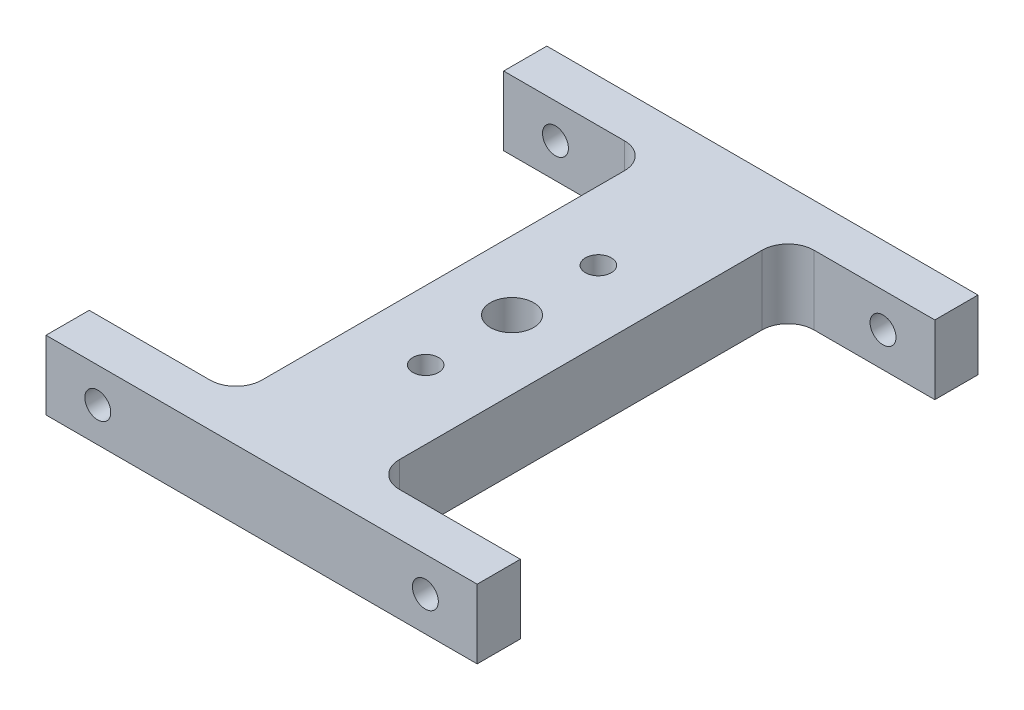
from build123d import *

# Parameters (mm, degrees)
SKETCH_1_W               = 49.93556627
SKETCH_1_H               = 8
EXTRUDE_1_DEPTH          = 58
SKETCH_2_R               = 2.5
SKETCH_2_R_2             = 1.5
CUT_EXTRUDE_1_DEPTH      = 10
CUT_EXTRUDE_2_DEPTH      = 53
CUT_EXTRUDE_2_DEPTH_BACK = 7
SKETCH_3_R               = 1.5
CHAMFER_1_SIZE           = 1.5


with BuildPart() as part:
    # 草图1 → 凸台-拉伸1 (new body)
    with BuildSketch(Plane.XY):
        with Locations((0, 106)):
            Rectangle(SKETCH_1_W, SKETCH_1_H)
    extrude(amount=EXTRUDE_1_DEPTH)

    # 草图2 → 切除-拉伸1 (cut)
    with BuildSketch(Plane(origin=(0, 110, 0), x_dir=(1, 0, 0), z_dir=(0, 1, 0))):
        with Locations(Location((0, -29, 0), (0, 0, 270))):
            Circle(SKETCH_2_R)
        with Locations(Location((0, -39, 0), (0, 0, 270))):
            Circle(SKETCH_2_R_2)
        with Locations(Location((0, -19, 0), (0, 0, 270))):
            Circle(SKETCH_2_R_2)
        with BuildLine():
            Line((24.967783135, -53), (10.967783135, -53))
            ThreePointArc((10.967783135, -53), (8.846462792, -52.121320344), (7.967783135, -50))
            Line((7.967783135, -50), (7.967783135, -8))
            ThreePointArc((7.967783135, -8), (8.846462792, -5.878679656), (10.967783135, -5))
            Line((10.967783135, -5), (24.967783135, -5))
            Line((24.967783135, -5), (24.967783135, -53))
        make_face()
        with BuildLine():
            Line((-7.967783135, -50), (-7.967783135, -8))
            ThreePointArc((-7.967783135, -8), (-8.846462792, -5.878679656), (-10.967783135, -5))
            Line((-10.967783135, -5), (-24.967783135, -5))
            Line((-24.967783135, -5), (-24.967783135, -53))
            Line((-24.967783135, -53), (-10.967783135, -53))
            ThreePointArc((-10.967783135, -53), (-8.846462792, -52.121320344), (-7.967783135, -50))
        make_face()
    extrude(amount=-CUT_EXTRUDE_1_DEPTH, mode=Mode.SUBTRACT)

    # 草图3 → 切除-拉伸2 (cut, two sides: drawn at the far end of the back side and taken through both)
    with BuildSketch(Plane.XY.offset(5).offset(-CUT_EXTRUDE_2_DEPTH_BACK)):
        with Locations(Location((18.967783135, 106, 0), (0, 0, 180))):
            Circle(SKETCH_3_R)
        with Locations(Location((-18.967783135, 106, 0), (0, 0, 180))):
            Circle(SKETCH_3_R)
    extrude(amount=CUT_EXTRUDE_2_DEPTH + CUT_EXTRUDE_2_DEPTH_BACK, mode=Mode.SUBTRACT)

    # 倒角1
    chamfer_1_edges = [part.edges().sort_by_distance(p)[0] for p in [
        (0, 102, 17.5),
        (0, 102, 37.5),
    ]]
    chamfer(chamfer_1_edges, length=CHAMFER_1_SIZE)


solid = part.part
